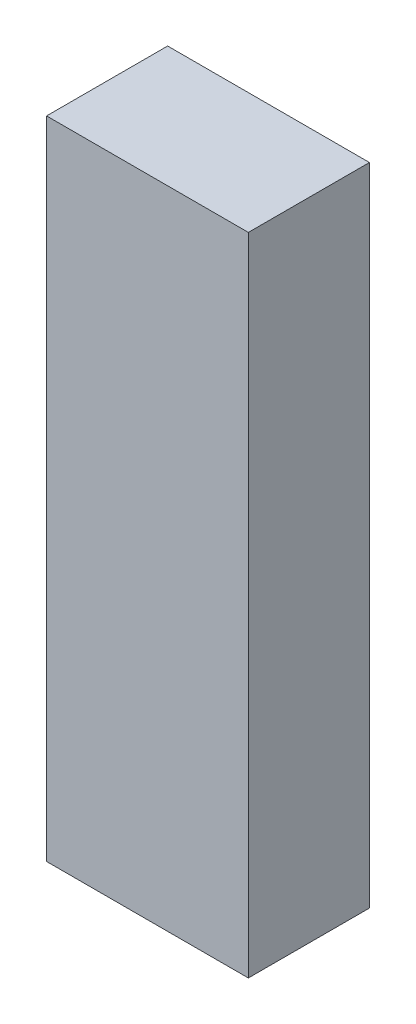
from build123d import *

# Parameters (mm, degrees)
SKETCH1_W           = 12.7
SKETCH1_H           = 40.64
BOSS_EXTRUDE1_DEPTH = 7.62


with BuildPart() as part:
    # Sketch1 → Boss-Extrude1 (new body)
    with BuildSketch(Plane.XY):
        with Locations((6.35, 20.32)):
            Rectangle(SKETCH1_W, SKETCH1_H)
    extrude(amount=BOSS_EXTRUDE1_DEPTH)


solid = part.part
